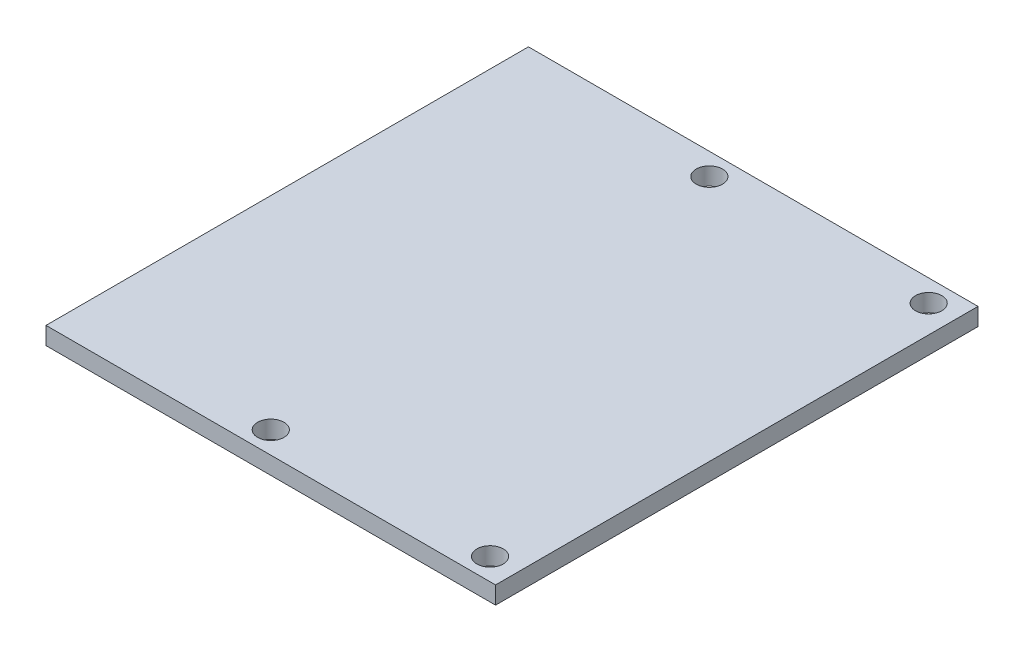
from build123d import *

# Parameters (mm, degrees)
SKETCH1_W           = 41
SKETCH1_H           = 44
SKETCH1_R           = 1.2
BOSS_EXTRUDE1_DEPTH = 1.6


with BuildPart() as part:
    # Sketch1 → Boss-Extrude1 (new body)
    with BuildSketch(Plane(origin=(0, 0, 0), x_dir=(1, 0, 0), z_dir=(0, 1, 0))):
        with Locations((20.5, 22)):
            Rectangle(SKETCH1_W, SKETCH1_H)
        with Locations((18.5, 2)):
            Circle(SKETCH1_R, mode=Mode.SUBTRACT)
        with Locations((38.5, 2)):
            Circle(SKETCH1_R, mode=Mode.SUBTRACT)
        with Locations((18.5, 42)):
            Circle(SKETCH1_R, mode=Mode.SUBTRACT)
        with Locations((38.5, 42)):
            Circle(SKETCH1_R, mode=Mode.SUBTRACT)
    extrude(amount=BOSS_EXTRUDE1_DEPTH)


solid = part.part
